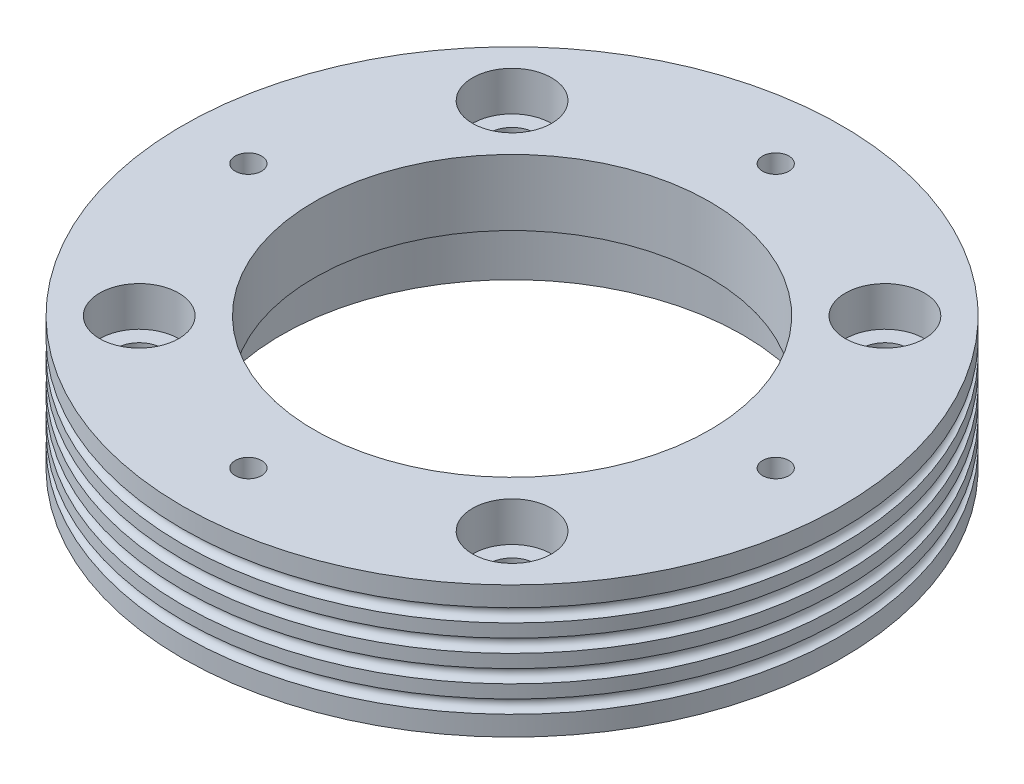
from build123d import *

# Parameters (mm, degrees)
SKETCH_1_R                = 25
EXTRUDE_1_DEPTH           = 10
HOLE_WIZARD_1_D           = 2
SKETCH_4_R                = 17.5
CUT_EXTRUDE_1_DEPTH       = 5
SKETCH_5_R                = 15
CUT_EXTRUDE_2_DEPTH       = 5
HOLE_WIZARD_3_D           = 3.5
HOLE_WIZARD_3_CBORE_D     = 6
HOLE_WIZARD_3_CBORE_DEPTH = 3
SWEEP_1_PROFILE_R         = 0.5
PATTERN_LINEAR_1_COUNT    = 4
PATTERN_LINEAR_1_PITCH    = 2


with BuildPart() as part:
    # 草图1 → 凸台-拉伸1 (new body)
    with BuildSketch(Plane(origin=(0, 0, 0), x_dir=(1, 0, 0), z_dir=(0, 1, 0))):
        with Locations(Location((0, 0, 0), (0, 0, 270))):
            Circle(SKETCH_1_R)
    extrude(amount=EXTRUDE_1_DEPTH)

    # 孔1 (through all)
    with Locations(Plane(origin=(0, 10, 0), x_dir=(1, 0, 0), z_dir=(0, 1, 0))):
        with Locations((0, -20), (20, 0), (0, 20), (-20, 0)):
            Hole(HOLE_WIZARD_1_D / 2)

    # 草图4 → 切除-拉伸1 (cut)
    with BuildSketch(Plane.XZ):
        with Locations(Location((0, 0, 0), (0, 0, 270))):
            Circle(SKETCH_4_R)
    extrude(amount=-CUT_EXTRUDE_1_DEPTH, mode=Mode.SUBTRACT)

    # 草图5 → 切除-拉伸2 (cut)
    with BuildSketch(Plane.XZ.offset(-5)):
        with Locations(Location((0, 0, 0), (0, 0, 270))):
            Circle(SKETCH_5_R)
    extrude(amount=-CUT_EXTRUDE_2_DEPTH, mode=Mode.SUBTRACT)

    # 孔3 (through all)
    with Locations(Plane(origin=(0, 10, 0), x_dir=(1, 0, 0), z_dir=(0, 1, 0))):
        with Locations((-14.142135624, 14.142135624), (14.142135624, 14.142135624), (14.142135624, -14.142135624), (-14.142135624, -14.142135624)):
            CounterBoreHole(HOLE_WIZARD_3_D / 2, HOLE_WIZARD_3_CBORE_D / 2, HOLE_WIZARD_3_CBORE_DEPTH)

    # 切除-扫描1: sweep along a path in 草图11
    with BuildLine(Plane(origin=(0, 2, 0), x_dir=(1, 0, 0), z_dir=(0, 1, 0))) as sweep_1_path:
        CenterArc((0, 0), 25, 0, 360)
    # 切除-扫描1 profile (on start of the path) → 切除-扫描1 (sweep, cut)
    with BuildSketch(Plane(origin=(25, 2, 0), x_dir=(-1, 0, 0), z_dir=(0, 0, -1))):
        Circle(SWEEP_1_PROFILE_R)
    sweep_1 = sweep(path=sweep_1_path.line, mode=Mode.SUBTRACT)

    # 阵列(线性)1: 切除-扫描1 ×4
    with Locations(*[(0, i * PATTERN_LINEAR_1_PITCH, 0) for i in range(1, PATTERN_LINEAR_1_COUNT)]):
        add(sweep_1, mode=Mode.SUBTRACT)


solid = part.part
